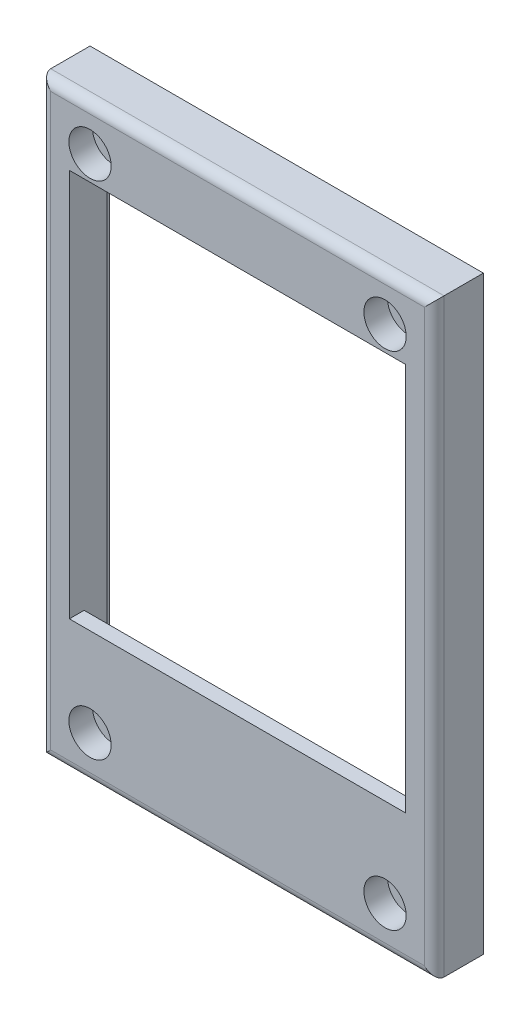
from build123d import *

# Parameters (mm, degrees)
SKETCH1_W           = 60
SKETCH1_H           = 40
BOSS_EXTRUDE1_DEPTH = 5
SKETCH2_W           = 34.2
SKETCH2_H           = 46
CUT_EXTRUDE1_DEPTH  = 73.284161474
SKETCH3_R           = 1.15
CUT_EXTRUDE2_DEPTH  = 73.284161474
SKETCH4_R           = 2.15
CUT_EXTRUDE3_DEPTH  = 2.4
SKETCH5_W           = 36
SKETCH5_H           = 56.5
CUT_EXTRUDE4_DEPTH  = 1.2
SKETCH6_W           = 25
SKETCH6_H           = 3
CUT_EXTRUDE5_DEPTH  = 2.5
FILLET1_R           = 1
BOSS_EXTRUDE2_REACH = 72.721
SKETCH7_W           = 6.5
SKETCH7_H           = 1.5


with BuildPart() as part:
    # Sketch1 → Boss-Extrude1 (new body)
    with BuildSketch(Plane(origin=(0, 0, 0), x_dir=(0, 1, 0), z_dir=(0, 0, 1))):
        with Locations((30, -20)):
            Rectangle(SKETCH1_W, SKETCH1_H)
    extrude(amount=BOSS_EXTRUDE1_DEPTH)

    # Sketch2 → Cut-Extrude1 (cut, through all)
    with BuildSketch(Plane(origin=(0, 0, 0), x_dir=(1, 0, 0), z_dir=(0, 0, -1))):
        with Locations((20, -30)):
            Rectangle(SKETCH2_W, SKETCH2_H)
    extrude(amount=-CUT_EXTRUDE1_DEPTH, mode=Mode.SUBTRACT)

    # Sketch3 → Cut-Extrude2 (cut, through all)
    with BuildSketch(Plane.XY.offset(5)):
        with Locations((5, 4.5)):
            Circle(SKETCH3_R)
        with Locations((35, 4.5)):
            Circle(SKETCH3_R)
        with Locations((5, 55.5)):
            Circle(SKETCH3_R)
        with Locations((35, 55.5)):
            Circle(SKETCH3_R)
    extrude(amount=-CUT_EXTRUDE2_DEPTH, mode=Mode.SUBTRACT)

    # Sketch4 → Cut-Extrude3 (cut)
    with BuildSketch(Plane.XY.offset(5)):
        with Locations((5, 55.5)):
            Circle(SKETCH4_R)
        with Locations((35, 55.5)):
            Circle(SKETCH4_R)
        with Locations((5, 4.5)):
            Circle(SKETCH4_R)
        with Locations((35, 4.5)):
            Circle(SKETCH4_R)
    extrude(amount=-CUT_EXTRUDE3_DEPTH, mode=Mode.SUBTRACT)

    # Sketch5 → Cut-Extrude4 (cut)
    with BuildSketch(Plane(origin=(0, 0, 0), x_dir=(1, 0, 0), z_dir=(0, 0, -1))):
        with Locations((20, -30)):
            Rectangle(SKETCH5_W, SKETCH5_H)
    extrude(amount=-CUT_EXTRUDE4_DEPTH, mode=Mode.SUBTRACT)

    # Sketch6 → Cut-Extrude5 (cut)
    with BuildSketch(Plane(origin=(0, 0, 1.2), x_dir=(1, 0, 0), z_dir=(0, 0, -1))):
        with Locations((20, -55.625)):
            Rectangle(SKETCH6_W, SKETCH6_H)
    extrude(amount=-CUT_EXTRUDE5_DEPTH, mode=Mode.SUBTRACT)

    # Fillet1
    fillet1_edges = [part.edges().sort_by_distance(p)[0] for p in [
        (20, 60, 5),
        (0, 30, 5),
        (20, 0, 5),
        (40, 30, 5),
    ]]
    fillet(fillet1_edges, radius=FILLET1_R)

    # Sketch7 → Boss-Extrude2 (add, up to next)
    with BuildSketch(Plane.YZ.offset(2.9), mode=Mode.PRIVATE) as boss_extrude2_sk1:
        with Locations((10.25, 4.25)):
            Rectangle(SKETCH7_W, SKETCH7_H)
    boss_extrude2_tool1 = extrude(boss_extrude2_sk1.sketch, amount=BOSS_EXTRUDE2_REACH, mode=Mode.PRIVATE) - part.part
    add(boss_extrude2_tool1.solids().sort_by_distance((2.9, 10.25, 4.25))[0])


solid = part.part
